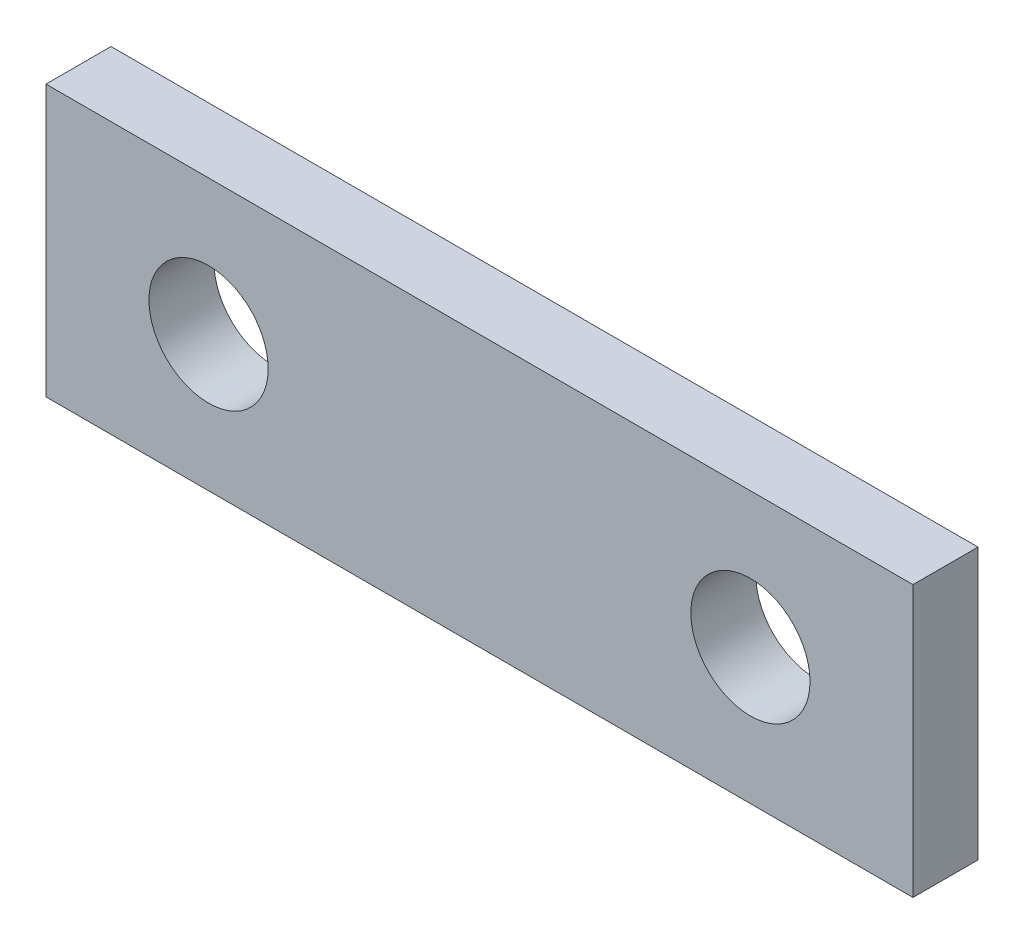
from build123d import *

# Parameters (mm, degrees)
SKIZZE1_W                       = 80
SKIZZE1_H                       = 25
SKIZZE1_R                       = 5.5
AUFSATZ_LINEAR_AUSTRAGEN1_DEPTH = 3


with BuildPart() as part:
    # Skizze1 → Aufsatz-Linear austragen1 (new, symmetric)
    with BuildSketch(Plane.XY):
        Rectangle(SKIZZE1_W, SKIZZE1_H)
        with Locations((-25, 0)):
            Circle(SKIZZE1_R, mode=Mode.SUBTRACT)
        with Locations((25, 0)):
            Circle(SKIZZE1_R, mode=Mode.SUBTRACT)
    extrude(amount=AUFSATZ_LINEAR_AUSTRAGEN1_DEPTH, both=True)


solid = part.part
